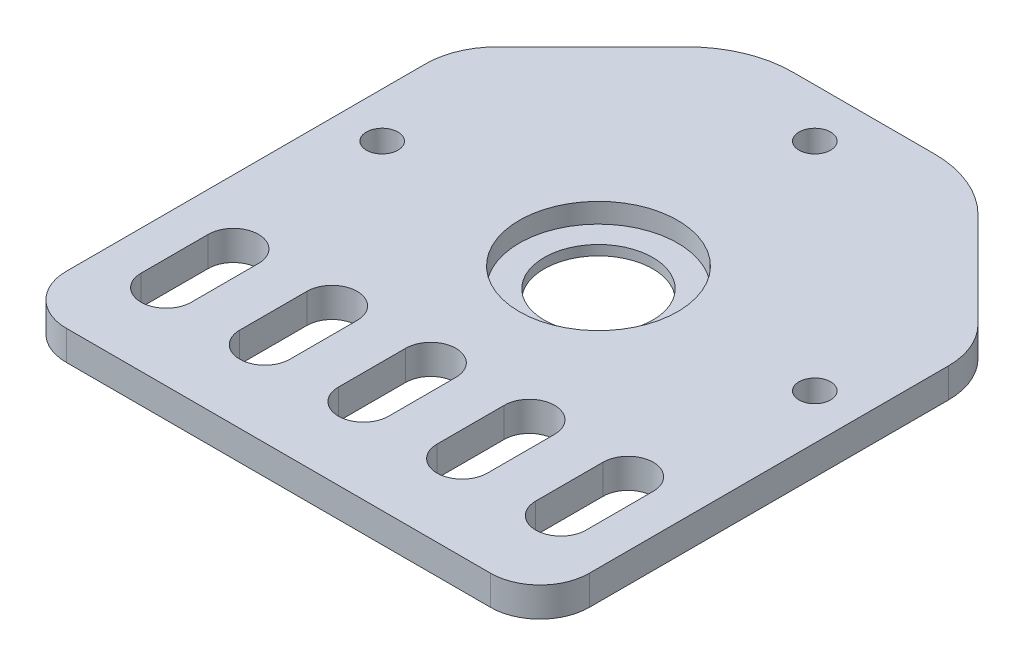
from build123d import *

# Parameters (mm, degrees)
SKETCH1_R           = 1.6
SKETCH1_R_2         = 5.5
BOSS_EXTRUDE1_DEPTH = 3
SKETCH2_R           = 8.025
CUT_EXTRUDE1_DEPTH  = 2


with BuildPart() as part:
    # Sketch1 → Boss-Extrude1 (new body)
    with BuildSketch(Plane(origin=(0, 0, 0), x_dir=(1, 0, 0), z_dir=(0, 1, 0))):
        with BuildLine():
            Line((21.5, -32.43), (-21.5, -32.43))
            ThreePointArc((-21.5, -32.43), (-25.035533906, -30.965533906), (-26.5, -27.43))
            Line((-26.5, -27.43), (-26.5, 8.956951673))
            ThreePointArc((-26.5, 8.956951673), (-25.948126611, 11.731406557), (-24.376524164, 14.083475836))
            Line((-24.376524164, 14.083475836), (-14.728099577, 23.731900423))
            ThreePointArc((-14.728099577, 23.731900423), (-11.263258212, 26.047033407), (-7.176199154, 26.86))
            Line((-7.176199154, 26.86), (7.176199154, 26.86))
            ThreePointArc((7.176199154, 26.86), (11.263258212, 26.047033407), (14.728099577, 23.731900423))
            Line((14.728099577, 23.731900423), (24.376524164, 14.083475836))
            ThreePointArc((24.376524164, 14.083475836), (25.948126611, 11.731406557), (26.5, 8.956951673))
            Line((26.5, 8.956951673), (26.5, -27.43))
            ThreePointArc((26.5, -27.43), (25.035533906, -30.965533906), (21.5, -32.43))
        make_face()
        with Locations(Location((21.920310217, 0, 0), (0, 0, 270))):
            Circle(SKETCH1_R, mode=Mode.SUBTRACT)
        with Locations(Location((-21.920310217, 0, 0), (0, 0, 90))):
            Circle(SKETCH1_R, mode=Mode.SUBTRACT)
        with Locations(Location((0, 0, 0), (0, 0, 270))):
            Circle(SKETCH1_R_2, mode=Mode.SUBTRACT)
        with Locations(Location((0, 21.920310217, 0), (0, 0, 270))):
            Circle(SKETCH1_R, mode=Mode.SUBTRACT)
        with BuildLine():
            Line((17.45, -23.81), (17.45, -17))
            ThreePointArc((17.45, -17), (20, -14.45), (22.55, -17))
            Line((22.55, -17), (22.55, -23.81))
            ThreePointArc((22.55, -23.81), (20, -26.36), (17.45, -23.81))
        make_face(mode=Mode.SUBTRACT)
        with BuildLine():
            Line((7.45, -23.81), (7.45, -17))
            ThreePointArc((7.45, -17), (10, -14.45), (12.55, -17))
            Line((12.55, -17), (12.55, -23.81))
            ThreePointArc((12.55, -23.81), (10, -26.36), (7.45, -23.81))
        make_face(mode=Mode.SUBTRACT)
        with BuildLine():
            Line((-2.55, -23.81), (-2.55, -17))
            ThreePointArc((-2.55, -17), (0, -14.45), (2.55, -17))
            Line((2.55, -17), (2.55, -23.81))
            ThreePointArc((2.55, -23.81), (0, -26.36), (-2.55, -23.81))
        make_face(mode=Mode.SUBTRACT)
        with BuildLine():
            Line((-12.55, -23.81), (-12.55, -17))
            ThreePointArc((-12.55, -17), (-10, -14.45), (-7.45, -17))
            Line((-7.45, -17), (-7.45, -23.81))
            ThreePointArc((-7.45, -23.81), (-10, -26.36), (-12.55, -23.81))
        make_face(mode=Mode.SUBTRACT)
        with BuildLine():
            Line((-22.55, -23.81), (-22.55, -17))
            ThreePointArc((-22.55, -17), (-20, -14.45), (-17.45, -17))
            Line((-17.45, -17), (-17.45, -23.81))
            ThreePointArc((-17.45, -23.81), (-20, -26.36), (-22.55, -23.81))
        make_face(mode=Mode.SUBTRACT)
    extrude(amount=BOSS_EXTRUDE1_DEPTH)

    # Sketch2 → Cut-Extrude1 (cut)
    with BuildSketch(Plane(origin=(0, 3, 0), x_dir=(1, 0, 0), z_dir=(0, 1, 0))):
        with Locations(Location((0, 0, 0), (0, 0, 270))):
            Circle(SKETCH2_R)
    extrude(amount=-CUT_EXTRUDE1_DEPTH, mode=Mode.SUBTRACT)


solid = part.part
